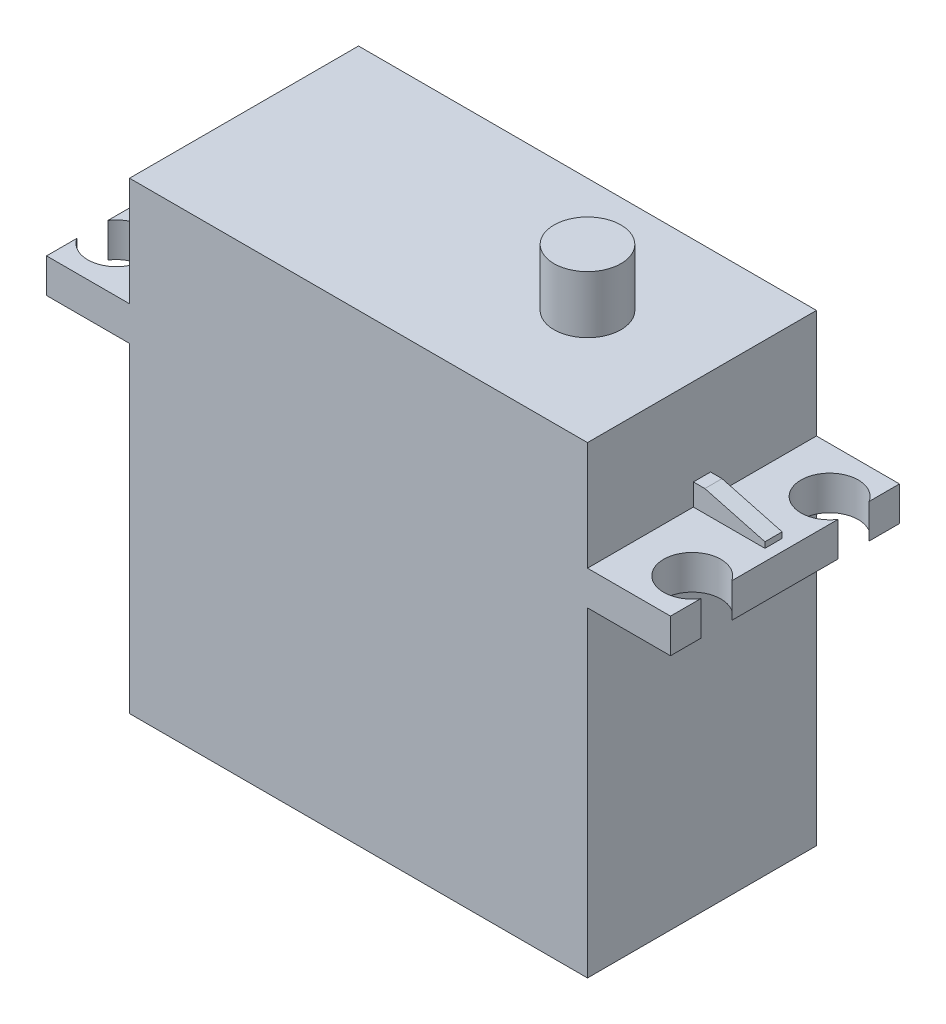
from build123d import *

# Parameters (mm, degrees)
SKETCH1_W           = 40
SKETCH1_H           = 20
BOSS_EXTRUDE1_DEPTH = 28
SKETCH2_W           = 54.5
SKETCH2_H           = 20
BOSS_EXTRUDE2_DEPTH = 3
SKETCH3_W           = 40
SKETCH3_H           = 20
BOSS_EXTRUDE3_DEPTH = 9.5
SKETCH4_R           = 2.925
BOSS_EXTRUDE4_DEPTH = 5
SKETCH5_R           = 2.5
CUT_EXTRUDE1_DEPTH  = 3
BOSS_EXTRUDE5_START = -10
BOSS_EXTRUDE5_DEPTH = 0.75


with BuildPart() as part:
    # Sketch1 → Boss-Extrude1 (new body)
    with BuildSketch(Plane(origin=(0, 0, 0), x_dir=(1, 0, 0), z_dir=(0, 1, 0))):
        Rectangle(SKETCH1_W, SKETCH1_H)
    extrude(amount=-BOSS_EXTRUDE1_DEPTH)

    # Sketch2 → Boss-Extrude2 (add)
    with BuildSketch(Plane(origin=(0, 0, 0), x_dir=(1, 0, 0), z_dir=(0, 1, 0))):
        Rectangle(SKETCH2_W, SKETCH2_H)
    extrude(amount=BOSS_EXTRUDE2_DEPTH)

    # Sketch3 → Boss-Extrude3 (add)
    with BuildSketch(Plane(origin=(0, 3, 0), x_dir=(1, 0, 0), z_dir=(0, 1, 0))):
        Rectangle(SKETCH3_W, SKETCH3_H)
    extrude(amount=BOSS_EXTRUDE3_DEPTH)

    # Sketch4 → Boss-Extrude4 (add)
    with BuildSketch(Plane(origin=(0, 12.5, 0), x_dir=(1, 0, 0), z_dir=(0, 1, 0))):
        with Locations(Location((10, 0, 0), (0, 0, 270))):
            Circle(SKETCH4_R)
    extrude(amount=BOSS_EXTRUDE4_DEPTH)

    # Sketch5 → Cut-Extrude1 (cut)
    with BuildSketch(Plane(origin=(0, 3, 0), x_dir=(1, 0, 0), z_dir=(0, 1, 0))):
        with Locations((25.15, -6)):
            Circle(SKETCH5_R)
        with Locations((25.15, 6)):
            Circle(SKETCH5_R)
        with Locations((-25.15, -6)):
            Circle(SKETCH5_R)
        with Locations((-25.15, 6)):
            Circle(SKETCH5_R)
    extrude(amount=-CUT_EXTRUDE1_DEPTH, mode=Mode.SUBTRACT)

    # Sketch6 → Boss-Extrude5 (add, symmetric)
    with BuildSketch(Plane(origin=(0, 0, -10), x_dir=(-1, 0, 0), z_dir=(0, 0, -1)).offset(BOSS_EXTRUDE5_START)):
        Polygon((-20, 3), (-20, 4.9), (-21, 4.9), (-26.25, 3.5), (-26.25, 3), align=None)
    boss_extrude5 = extrude(amount=BOSS_EXTRUDE5_DEPTH, both=True)

    # Mirror1: Boss-Extrude5 across plane
    add(boss_extrude5.mirror(Plane(origin=(0, 0, 0), x_dir=(0, 0, 1), z_dir=(1, 0, 0))))


solid = part.part
